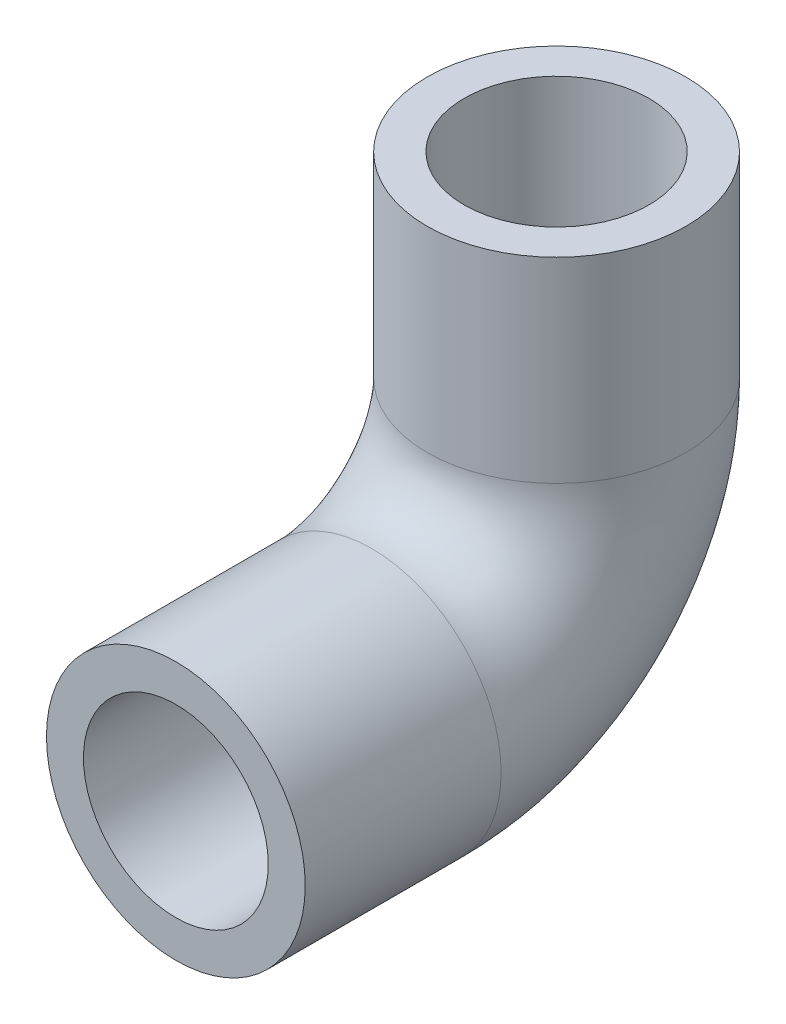
from build123d import *

# Parameters (mm, degrees)
SKETCH1_R           = 8.89
SKETCH1_R_2         = 6.35
BOSS_EXTRUDE1_DEPTH = 13.462
SKETCH3_R           = 8.89
SKETCH3_R_2         = 6.35
SKETCH5_R           = 8.89
SKETCH5_R_2         = 6.349329507
BOSS_EXTRUDE2_DEPTH = 13.462


with BuildPart() as part:
    # Sketch1 → Boss-Extrude1 (new body)
    with BuildSketch(Plane(origin=(0, 0, 0), x_dir=(1, 0, 0), z_dir=(0, 1, 0))):
        with Locations(Location((0, 0, 0), (0, 0, 270))):
            Circle(SKETCH1_R)
        with Locations(Location((0, 0, 0), (0, 0, 270))):
            Circle(SKETCH1_R_2, mode=Mode.SUBTRACT)
    extrude(amount=BOSS_EXTRUDE1_DEPTH)

    # Sweep1: sweep along a path in Sketch2
    with BuildLine(Plane(origin=(0, 0, 0), x_dir=(0, 0, -1), z_dir=(1, 0, 0))) as sweep1_path:
        ThreePointArc((0, 0), (-3.719743879, -8.980256121), (-12.7, -12.7))
    # Sketch3 → Sweep1 (sweep)
    with BuildSketch(Plane.XZ):
        Circle(SKETCH3_R)
        Circle(SKETCH3_R_2, mode=Mode.SUBTRACT)
    sweep(path=sweep1_path.line)

    # Sketch5 → Boss-Extrude2 (add)
    with BuildSketch(Plane.XY.offset(12.7)):
        with Locations(Location((0, -12.7, 0), (0, 0, 270))):
            Circle(SKETCH5_R)
        with Locations(Location((0, -12.7, 0), (0, 0, 270))):
            Circle(SKETCH5_R_2, mode=Mode.SUBTRACT)
    extrude(amount=BOSS_EXTRUDE2_DEPTH)


solid = part.part
